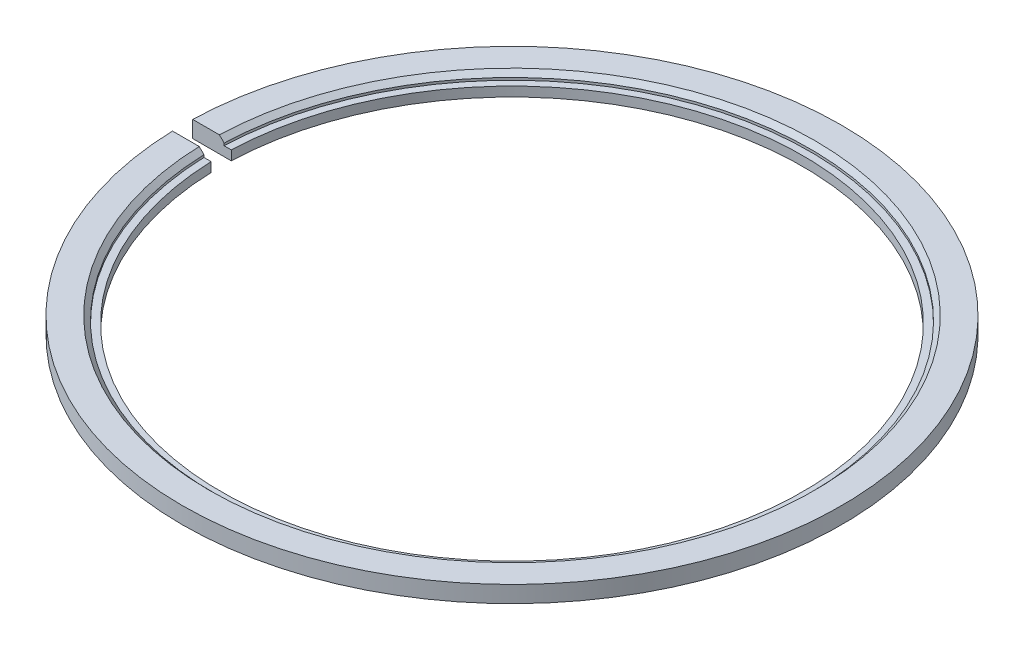
from build123d import *

# Parameters (mm, degrees)
CHAMFER1_SIZE      = 0.508
SKETCH4_W          = 4.146231659
SKETCH4_H          = 2.159
CUT_EXTRUDE1_DEPTH = 50.872125446


with BuildPart() as part:
    # Sketch1 → Revolve1 (revolve)
    with BuildSketch(Plane.XY, mode=Mode.PRIVATE) as revolve1_sk:
        Polygon((35.2425, 1.778), (31.877, 1.778), (31.877, 1.016), (31.115, 1.016), (31.115, 0), (35.2425, 0), align=None)
    revolve(revolve1_sk.sketch.rotate(Axis((0, 0, 0), (0, 1, 0)), 90), axis=Axis((0, 0, 0), (0, 1, 0)))

    # Chamfer1
    chamfer1_edges = [part.edges().sort_by_distance(p)[0] for p in [
        (0, 1.778, 31.877),
    ]]
    chamfer(chamfer1_edges, length=CHAMFER1_SIZE)

    # Sketch4 → Cut-Extrude1 (cut, through all)
    with BuildSketch(Plane(origin=(0, 1.778, 0), x_dir=(1, 0, 0), z_dir=(0, 1, 0))):
        with Locations((-33.169384171, 0)):
            Rectangle(SKETCH4_W, SKETCH4_H)
    extrude(amount=-CUT_EXTRUDE1_DEPTH, mode=Mode.SUBTRACT)


solid = part.part
